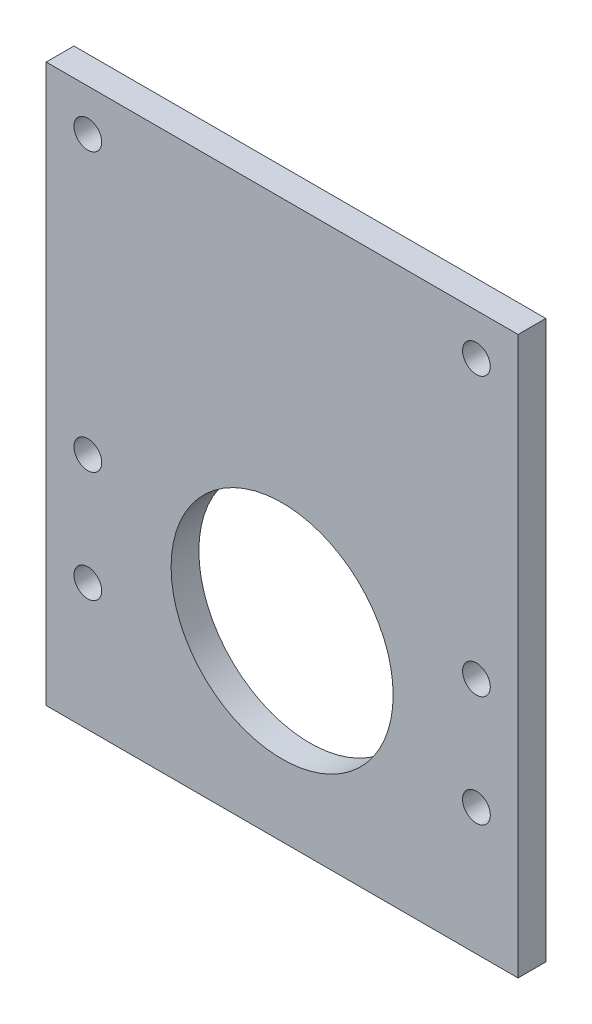
from build123d import *

# Parameters (mm, degrees)
SKETCH1_W           = 107.95
SKETCH1_H           = 127.508
SKETCH1_R           = 25.4
SKETCH1_R_2         = 3.175
BOSS_EXTRUDE1_DEPTH = 6.35


with BuildPart() as part:
    # Sketch1 → Boss-Extrude1 (new body)
    with BuildSketch(Plane.XY):
        with Locations((0, 21.971)):
            Rectangle(SKETCH1_W, SKETCH1_H)
        Circle(SKETCH1_R, mode=Mode.SUBTRACT)
        with Locations((-44.45, 76.2)):
            Circle(SKETCH1_R_2, mode=Mode.SUBTRACT)
        with Locations((44.45, 76.2)):
            Circle(SKETCH1_R_2, mode=Mode.SUBTRACT)
        with Locations((-44.45, 12.7)):
            Circle(SKETCH1_R_2, mode=Mode.SUBTRACT)
        with Locations((-44.45, -12.7)):
            Circle(SKETCH1_R_2, mode=Mode.SUBTRACT)
        with Locations(Location((44.45, -12.7, 0), (0, 0, 180))):
            Circle(SKETCH1_R_2, mode=Mode.SUBTRACT)
        with Locations(Location((44.45, 12.7, 0), (0, 0, 180))):
            Circle(SKETCH1_R_2, mode=Mode.SUBTRACT)
    extrude(amount=BOSS_EXTRUDE1_DEPTH)


solid = part.part
